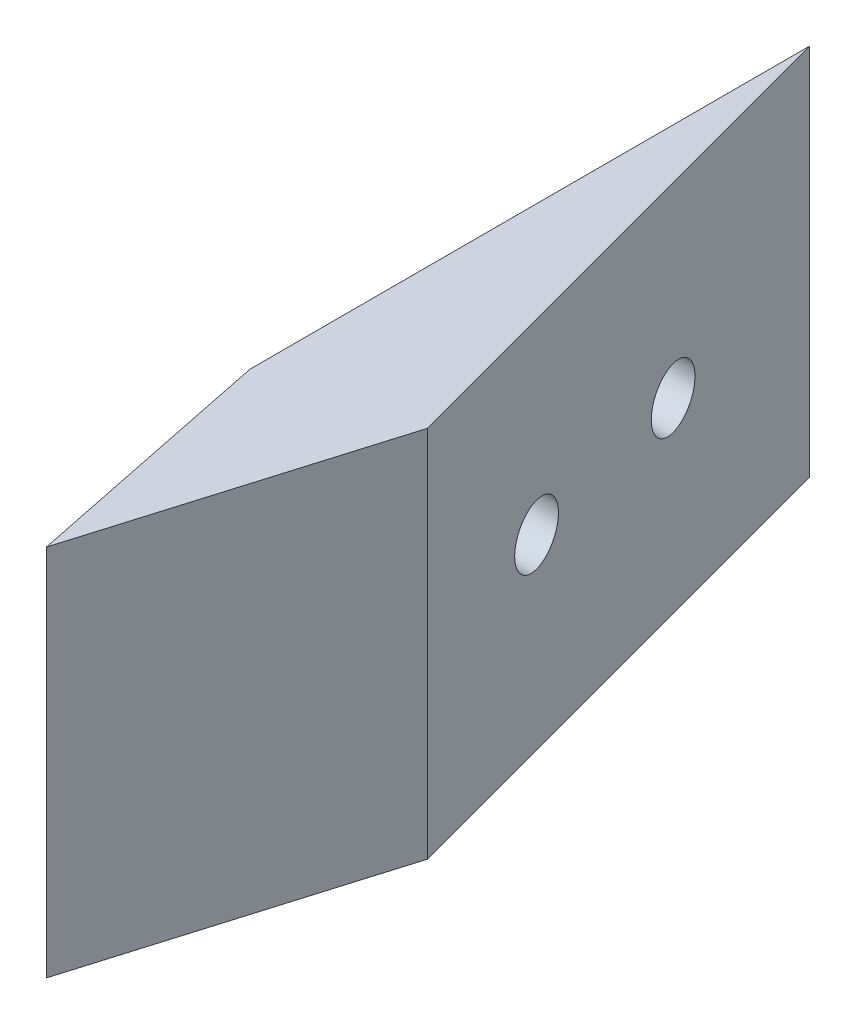
from build123d import *

# Parameters (mm, degrees)
SKETCH_2_W          = 5
SKETCH_2_H          = 32
EXTRUDE_1_DEPTH     = 10
CUT_EXTRUDE_1_DEPTH = 34.619190948
SKETCH_4_R          = 0.8
CUT_EXTRUDE_2_DEPTH = 25.328165537


with BuildPart() as part:
    # 草图2 → 凸台-拉伸1 (new body)
    with BuildSketch(Plane(origin=(0, 0, 0), x_dir=(1, 0, 0), z_dir=(0, 1, 0))):
        with Locations((0, -16)):
            Rectangle(SKETCH_2_W, SKETCH_2_H)
    extrude(amount=EXTRUDE_1_DEPTH)

    # 草图3 → 切除-拉伸1 (cut, through all)
    with BuildSketch(Plane(origin=(0, 10, 0), x_dir=(1, 0, 0), z_dir=(0, 1, 0))):
        Polygon((2.5, -18.660254038), (1.25, -13.995190528), (-1.1, -21.85857128), (-2.5, -15), (-2.5, -32), (2.5, -32), align=None)
        Polygon((2.5, 0), (-2.5, 0), (1.25, -13.995190528), (2.5, -18.660254038), align=None)
    extrude(amount=-CUT_EXTRUDE_1_DEPTH, mode=Mode.SUBTRACT)

    # 草图4 → 切除-拉伸2 (cut, through all)
    with BuildSketch(Plane.ZY.offset(2.5)):
        with Locations((5, 5)):
            Circle(SKETCH_4_R)
        with Locations((10, 5)):
            Circle(SKETCH_4_R)
    extrude(amount=-CUT_EXTRUDE_2_DEPTH, mode=Mode.SUBTRACT)


solid = part.part
